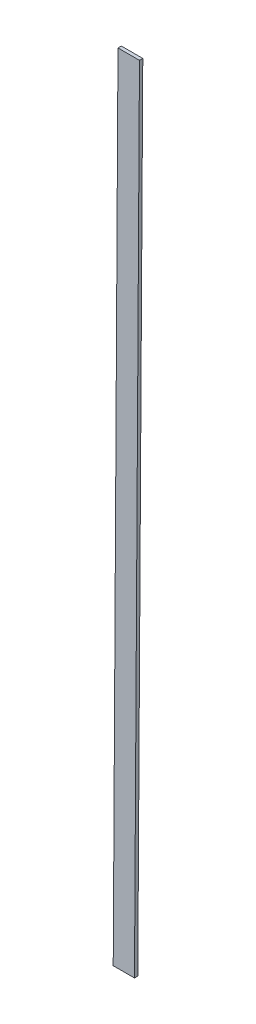
from build123d import *

# Parameters (mm, degrees)
BOSS_EXTRUDE1_DEPTH = 1.5875


with BuildPart() as part:
    # Sketch1 → Boss-Extrude1 (new body)
    with BuildSketch(Plane.XY):
        Polygon((-60.349165418, -88.45714973), (-50.189165418, -88.45714973), (-47.798286328, 292.553338009), (-58.070204318, 292.553338009), align=None)
    extrude(amount=BOSS_EXTRUDE1_DEPTH)


solid = part.part
